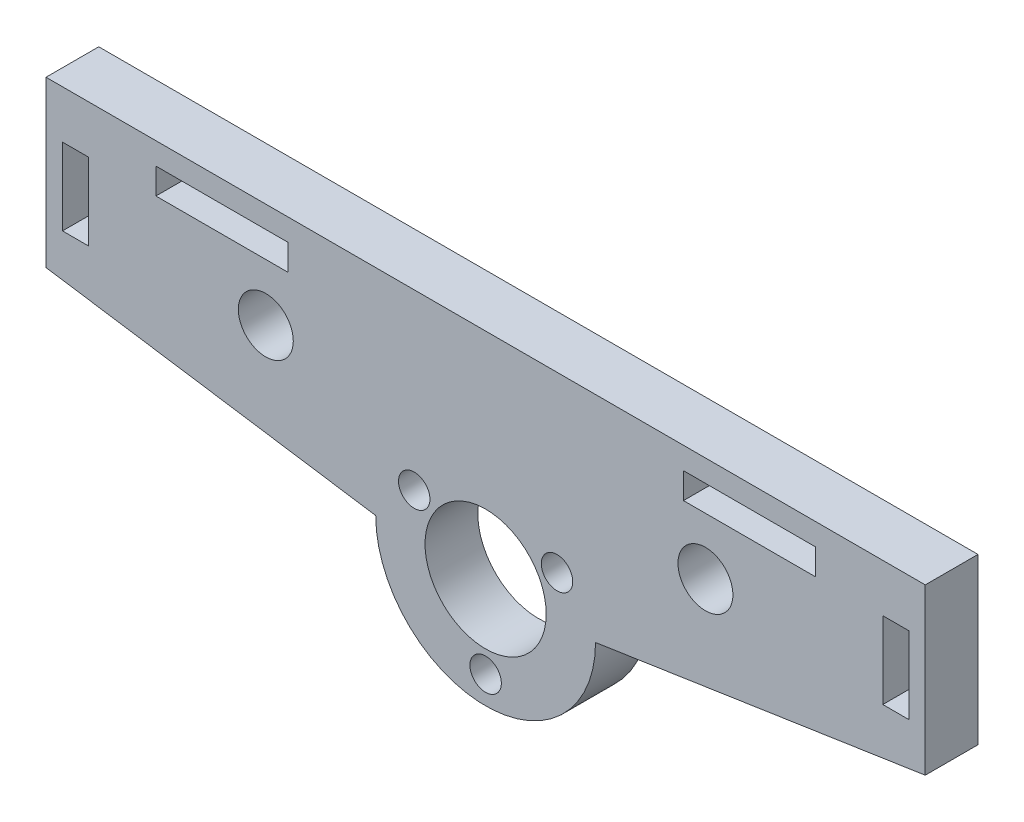
from build123d import *

# Parameters (mm, degrees)
SKETCH1_R           = 3.175
SKETCH1_R_2         = 1.8161
SKETCH1_R_3         = 7
BOSS_EXTRUDE1_DEPTH = 6.096
SKETCH2_W           = 15.24
SKETCH2_H           = 2.9972
CUT_EXTRUDE1_DEPTH  = 57.86462381
SKETCH3_W           = 2.9972
SKETCH3_H           = 8.89
CUT_EXTRUDE2_DEPTH  = 57.86462381


with BuildPart() as part:
    # Sketch1 → Boss-Extrude1 (new body)
    with BuildSketch(Plane.XY):
        with BuildLine():
            Line((-50.8, 24.815), (50.8, 24.815))
            Line((50.8, 24.815), (50.8, 5.765))
            Line((50.8, 5.765), (12.7, 0))
            ThreePointArc((12.7, 0), (0, -12.7), (-12.7, 0))
            Line((-12.7, 0), (-50.8, 5.765))
            Line((-50.8, 5.765), (-50.8, 24.815))
        make_face()
        with Locations((25.4, 12.7)):
            Circle(SKETCH1_R, mode=Mode.SUBTRACT)
        with Locations((-25.4, 12.7)):
            Circle(SKETCH1_R, mode=Mode.SUBTRACT)
        with Locations((-8.248891971, 4.7625)):
            Circle(SKETCH1_R_2, mode=Mode.SUBTRACT)
        Circle(SKETCH1_R_3, mode=Mode.SUBTRACT)
        with Locations((8.248891971, 4.7625)):
            Circle(SKETCH1_R_2, mode=Mode.SUBTRACT)
        with Locations((0, -9.525)):
            Circle(SKETCH1_R_2, mode=Mode.SUBTRACT)
    extrude(amount=-BOSS_EXTRUDE1_DEPTH)

    # Sketch2 → Cut-Extrude1 (cut, through all)
    with BuildSketch(Plane.XY):
        with Locations((-30.48, 20.7764)):
            Rectangle(SKETCH2_W, SKETCH2_H)
        with Locations((30.48, 20.7764)):
            Rectangle(SKETCH2_W, SKETCH2_H)
    extrude(amount=-CUT_EXTRUDE1_DEPTH, mode=Mode.SUBTRACT)

    # Sketch3 → Cut-Extrude2 (cut, through all)
    with BuildSketch(Plane.XY):
        with Locations((-47.3964, 14.8328)):
            Rectangle(SKETCH3_W, SKETCH3_H)
        with Locations((47.3964, 14.8328)):
            Rectangle(SKETCH3_W, SKETCH3_H)
    extrude(amount=-CUT_EXTRUDE2_DEPTH, mode=Mode.SUBTRACT)


solid = part.part
